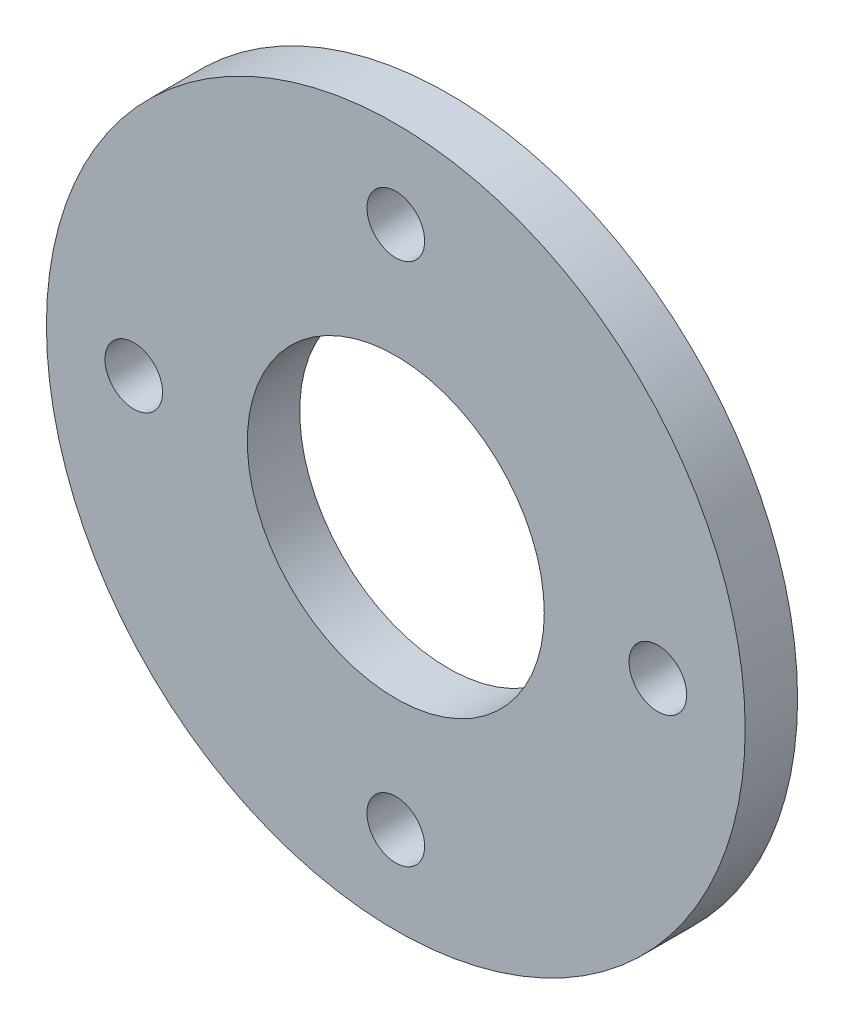
from build123d import *

# Parameters (mm, degrees)
SKETCH_2_R      = 20
SKETCH_2_R_2    = 8.5
SKETCH_2_R_3    = 1.65
EXTRUDE_1_DEPTH = 3


with BuildPart() as part:
    # 草图2 → 凸台-拉伸1 (new body)
    with BuildSketch(Plane.XY):
        Circle(SKETCH_2_R)
        Circle(SKETCH_2_R_2, mode=Mode.SUBTRACT)
        with Locations((0, 15)):
            Circle(SKETCH_2_R_3, mode=Mode.SUBTRACT)
        with Locations((15, 0)):
            Circle(SKETCH_2_R_3, mode=Mode.SUBTRACT)
        with Locations((-15, 0)):
            Circle(SKETCH_2_R_3, mode=Mode.SUBTRACT)
        with Locations((0, -15)):
            Circle(SKETCH_2_R_3, mode=Mode.SUBTRACT)
    extrude(amount=EXTRUDE_1_DEPTH)


solid = part.part
